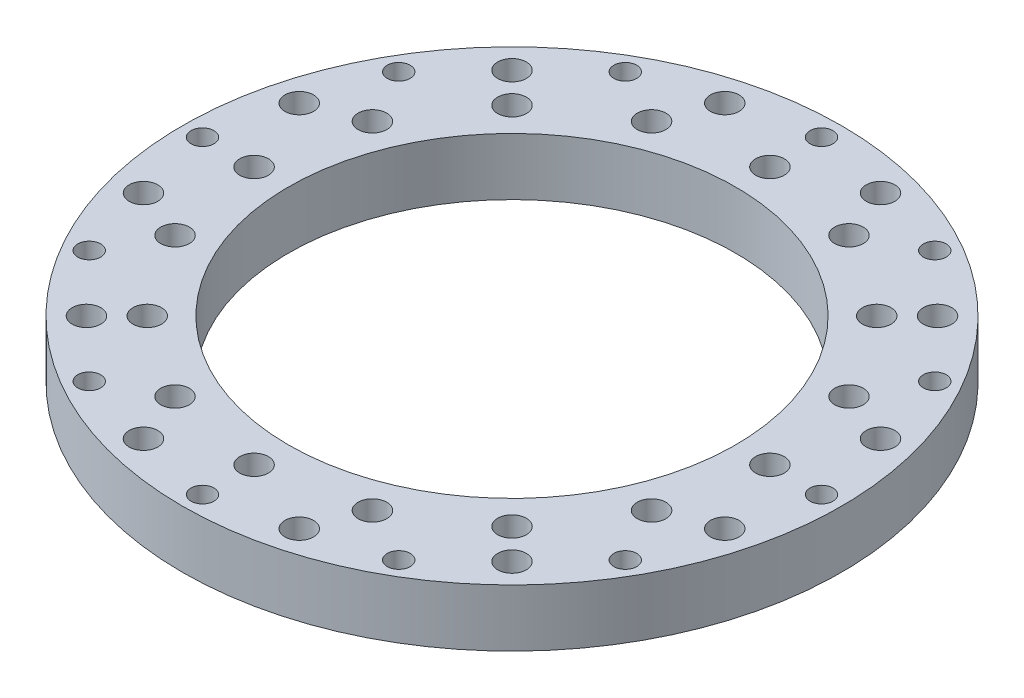
from build123d import *

# Parameters (mm, degrees)
SKETCH1_R           = 57.5
SKETCH1_R_2         = 39
SKETCH1_R_3         = 2
SKETCH1_R_4         = 2.5
BOSS_EXTRUDE1_DEPTH = 10
SKETCH2_R           = 2.5
CUT_EXTRUDE1_DEPTH  = 10
SKETCH4_R           = 5
SKETCH4_R_2         = 2.5
BOSS_EXTRUDE3_DEPTH = 0.4


with BuildPart() as part:
    # Sketch1 → Boss-Extrude1 (new body)
    with BuildSketch(Plane(origin=(0, 0, 0), x_dir=(1, 0, 0), z_dir=(0, 1, 0))):
        with Locations(Location((0, 0, 0), (0, 0, 270))):
            Circle(SKETCH1_R)
        with Locations(Location((0, 0, 0), (0, 0, 270))):
            Circle(SKETCH1_R_2, mode=Mode.SUBTRACT)
        with Locations(Location((0, 54, 0), (0, 0, 270))):
            Circle(SKETCH1_R_3, mode=Mode.SUBTRACT)
        with Locations(Location((27, 46.765371804, 0), (0, 0, 270))):
            Circle(SKETCH1_R_3, mode=Mode.SUBTRACT)
        with Locations(Location((46.765371804, 27, 0), (0, 0, 270))):
            Circle(SKETCH1_R_3, mode=Mode.SUBTRACT)
        with Locations(Location((54, 0, 0), (0, 0, 270))):
            Circle(SKETCH1_R_3, mode=Mode.SUBTRACT)
        with Locations(Location((46.765371804, -27, 0), (0, 0, 270))):
            Circle(SKETCH1_R_3, mode=Mode.SUBTRACT)
        with Locations(Location((27, -46.765371804, 0), (0, 0, 270))):
            Circle(SKETCH1_R_3, mode=Mode.SUBTRACT)
        with Locations(Location((0, -54, 0), (0, 0, 270))):
            Circle(SKETCH1_R_3, mode=Mode.SUBTRACT)
        with Locations(Location((-27, -46.765371804, 0), (0, 0, 270))):
            Circle(SKETCH1_R_3, mode=Mode.SUBTRACT)
        with Locations(Location((-46.765371804, -27, 0), (0, 0, 270))):
            Circle(SKETCH1_R_3, mode=Mode.SUBTRACT)
        with Locations(Location((-54, 0, 0), (0, 0, 270))):
            Circle(SKETCH1_R_3, mode=Mode.SUBTRACT)
        with Locations(Location((-46.765371804, 27, 0), (0, 0, 270))):
            Circle(SKETCH1_R_3, mode=Mode.SUBTRACT)
        with Locations(Location((-27, 46.765371804, 0), (0, 0, 270))):
            Circle(SKETCH1_R_3, mode=Mode.SUBTRACT)
        with Locations(Location((13.587999868, 50.71110588, 0), (0, 0, 270))):
            Circle(SKETCH1_R_4, mode=Mode.SUBTRACT)
        with Locations(Location((37.123106012, 37.123106012, 0), (0, 0, 270))):
            Circle(SKETCH1_R_4, mode=Mode.SUBTRACT)
        with Locations(Location((50.71110588, 13.587999868, 0), (0, 0, 270))):
            Circle(SKETCH1_R_4, mode=Mode.SUBTRACT)
        with Locations(Location((50.71110588, -13.587999868, 0), (0, 0, 270))):
            Circle(SKETCH1_R_4, mode=Mode.SUBTRACT)
        with Locations(Location((37.123106012, -37.123106012, 0), (0, 0, 270))):
            Circle(SKETCH1_R_4, mode=Mode.SUBTRACT)
        with Locations(Location((13.587999868, -50.71110588, 0), (0, 0, 270))):
            Circle(SKETCH1_R_4, mode=Mode.SUBTRACT)
        with Locations(Location((-13.587999868, -50.71110588, 0), (0, 0, 270))):
            Circle(SKETCH1_R_4, mode=Mode.SUBTRACT)
        with Locations(Location((-37.123106012, -37.123106012, 0), (0, 0, 270))):
            Circle(SKETCH1_R_4, mode=Mode.SUBTRACT)
        with Locations(Location((-50.71110588, -13.587999868, 0), (0, 0, 270))):
            Circle(SKETCH1_R_4, mode=Mode.SUBTRACT)
        with Locations(Location((-50.71110588, 13.587999868, 0), (0, 0, 270))):
            Circle(SKETCH1_R_4, mode=Mode.SUBTRACT)
        with Locations(Location((-37.123106012, 37.123106012, 0), (0, 0, 270))):
            Circle(SKETCH1_R_4, mode=Mode.SUBTRACT)
        with Locations(Location((-13.587999868, 50.71110588, 0), (0, 0, 270))):
            Circle(SKETCH1_R_4, mode=Mode.SUBTRACT)
    extrude(amount=BOSS_EXTRUDE1_DEPTH)

    # Sketch2 → Cut-Extrude1 (cut)
    with BuildSketch(Plane(origin=(0, 10, 0), x_dir=(1, 0, 0), z_dir=(0, 1, 0))):
        with Locations(Location((0, 45, 0), (0, 0, 270))):
            Circle(SKETCH2_R)
        with Locations(Location((17.220754456, 41.574578963, 0), (0, 0, 270))):
            Circle(SKETCH2_R)
        with Locations(Location((31.819805153, 31.819805153, 0), (0, 0, 270))):
            Circle(SKETCH2_R)
        with Locations(Location((41.574578963, 17.220754456, 0), (0, 0, 270))):
            Circle(SKETCH2_R)
        with Locations(Location((45, 0, 0), (0, 0, 270))):
            Circle(SKETCH2_R)
        with Locations(Location((41.574578963, -17.220754456, 0), (0, 0, 270))):
            Circle(SKETCH2_R)
        with Locations(Location((31.819805153, -31.819805153, 0), (0, 0, 270))):
            Circle(SKETCH2_R)
        with Locations(Location((17.220754456, -41.574578963, 0), (0, 0, 270))):
            Circle(SKETCH2_R)
        with Locations(Location((0, -45, 0), (0, 0, 270))):
            Circle(SKETCH2_R)
        with Locations(Location((-17.220754456, -41.574578963, 0), (0, 0, 270))):
            Circle(SKETCH2_R)
        with Locations(Location((-31.819805153, -31.819805153, 0), (0, 0, 270))):
            Circle(SKETCH2_R)
        with Locations(Location((-41.574578963, -17.220754456, 0), (0, 0, 270))):
            Circle(SKETCH2_R)
        with Locations(Location((-45, 0, 0), (0, 0, 270))):
            Circle(SKETCH2_R)
        with Locations(Location((-41.574578963, 17.220754456, 0), (0, 0, 270))):
            Circle(SKETCH2_R)
        with Locations(Location((-31.819805153, 31.819805153, 0), (0, 0, 270))):
            Circle(SKETCH2_R)
        with Locations(Location((-17.220754456, 41.574578963, 0), (0, 0, 270))):
            Circle(SKETCH2_R)
    extrude(amount=-CUT_EXTRUDE1_DEPTH, mode=Mode.SUBTRACT)

    # Sketch4 → Boss-Extrude3 (add)
    # profile 1 of 16: a face of its own
    with BuildSketch(Plane(origin=(0, 0, 0), x_dir=(1, 0, 0), z_dir=(0, 1, 0))):
        with Locations(Location((0, 45, 0), (0, 0, 270))):
            Circle(SKETCH4_R)
        with Locations(Location((0, 45, 0), (0, 0, 270))):
            Circle(SKETCH4_R_2, mode=Mode.SUBTRACT)
    # profile 2 of 16: a face of its own
    with BuildSketch(Plane(origin=(0, 0, 0), x_dir=(1, 0, 0), z_dir=(0, 1, 0))):
        with Locations(Location((17.220754456, 41.574578963, 0), (0, 0, 270))):
            Circle(SKETCH4_R)
        with Locations(Location((17.220754456, 41.574578963, 0), (0, 0, 270))):
            Circle(SKETCH4_R_2, mode=Mode.SUBTRACT)
    # profile 3 of 16: a face of its own
    with BuildSketch(Plane(origin=(0, 0, 0), x_dir=(1, 0, 0), z_dir=(0, 1, 0))):
        with Locations(Location((31.819805153, 31.819805153, 0), (0, 0, 270))):
            Circle(SKETCH4_R)
        with Locations(Location((31.819805153, 31.819805153, 0), (0, 0, 270))):
            Circle(SKETCH4_R_2, mode=Mode.SUBTRACT)
    # profile 4 of 16: a face of its own
    with BuildSketch(Plane(origin=(0, 0, 0), x_dir=(1, 0, 0), z_dir=(0, 1, 0))):
        with Locations(Location((41.574578963, 17.220754456, 0), (0, 0, 270))):
            Circle(SKETCH4_R)
        with Locations(Location((41.574578963, 17.220754456, 0), (0, 0, 270))):
            Circle(SKETCH4_R_2, mode=Mode.SUBTRACT)
    # profile 5 of 16: a face of its own
    with BuildSketch(Plane(origin=(0, 0, 0), x_dir=(1, 0, 0), z_dir=(0, 1, 0))):
        with Locations(Location((45, 0, 0), (0, 0, 270))):
            Circle(SKETCH4_R)
        with Locations(Location((45, 0, 0), (0, 0, 270))):
            Circle(SKETCH4_R_2, mode=Mode.SUBTRACT)
    # profile 6 of 16: a face of its own
    with BuildSketch(Plane(origin=(0, 0, 0), x_dir=(1, 0, 0), z_dir=(0, 1, 0))):
        with Locations(Location((41.574578963, -17.220754456, 0), (0, 0, 270))):
            Circle(SKETCH4_R)
        with Locations(Location((41.574578963, -17.220754456, 0), (0, 0, 270))):
            Circle(SKETCH4_R_2, mode=Mode.SUBTRACT)
    # profile 7 of 16: a face of its own
    with BuildSketch(Plane(origin=(0, 0, 0), x_dir=(1, 0, 0), z_dir=(0, 1, 0))):
        with Locations(Location((31.819805153, -31.819805153, 0), (0, 0, 270))):
            Circle(SKETCH4_R)
        with Locations(Location((31.819805153, -31.819805153, 0), (0, 0, 270))):
            Circle(SKETCH4_R_2, mode=Mode.SUBTRACT)
    # profile 8 of 16: a face of its own
    with BuildSketch(Plane(origin=(0, 0, 0), x_dir=(1, 0, 0), z_dir=(0, 1, 0))):
        with Locations(Location((17.220754456, -41.574578963, 0), (0, 0, 270))):
            Circle(SKETCH4_R)
        with Locations(Location((17.220754456, -41.574578963, 0), (0, 0, 270))):
            Circle(SKETCH4_R_2, mode=Mode.SUBTRACT)
    # profile 9 of 16: a face of its own
    with BuildSketch(Plane(origin=(0, 0, 0), x_dir=(1, 0, 0), z_dir=(0, 1, 0))):
        with Locations(Location((0, -45, 0), (0, 0, 270))):
            Circle(SKETCH4_R)
        with Locations(Location((0, -45, 0), (0, 0, 270))):
            Circle(SKETCH4_R_2, mode=Mode.SUBTRACT)
    # profile 10 of 16: a face of its own
    with BuildSketch(Plane(origin=(0, 0, 0), x_dir=(1, 0, 0), z_dir=(0, 1, 0))):
        with Locations(Location((-17.220754456, -41.574578963, 0), (0, 0, 270))):
            Circle(SKETCH4_R)
        with Locations(Location((-17.220754456, -41.574578963, 0), (0, 0, 270))):
            Circle(SKETCH4_R_2, mode=Mode.SUBTRACT)
    # profile 11 of 16: a face of its own
    with BuildSketch(Plane(origin=(0, 0, 0), x_dir=(1, 0, 0), z_dir=(0, 1, 0))):
        with Locations(Location((-31.819805153, -31.819805153, 0), (0, 0, 270))):
            Circle(SKETCH4_R)
        with Locations(Location((-31.819805153, -31.819805153, 0), (0, 0, 270))):
            Circle(SKETCH4_R_2, mode=Mode.SUBTRACT)
    # profile 12 of 16: a face of its own
    with BuildSketch(Plane(origin=(0, 0, 0), x_dir=(1, 0, 0), z_dir=(0, 1, 0))):
        with Locations(Location((-41.574578963, -17.220754456, 0), (0, 0, 270))):
            Circle(SKETCH4_R)
        with Locations(Location((-41.574578963, -17.220754456, 0), (0, 0, 270))):
            Circle(SKETCH4_R_2, mode=Mode.SUBTRACT)
    # profile 13 of 16: a face of its own
    with BuildSketch(Plane(origin=(0, 0, 0), x_dir=(1, 0, 0), z_dir=(0, 1, 0))):
        with Locations(Location((-45, 0, 0), (0, 0, 270))):
            Circle(SKETCH4_R)
        with Locations(Location((-45, 0, 0), (0, 0, 270))):
            Circle(SKETCH4_R_2, mode=Mode.SUBTRACT)
    # profile 14 of 16: a face of its own
    with BuildSketch(Plane(origin=(0, 0, 0), x_dir=(1, 0, 0), z_dir=(0, 1, 0))):
        with Locations(Location((-41.574578963, 17.220754456, 0), (0, 0, 270))):
            Circle(SKETCH4_R)
        with Locations(Location((-41.574578963, 17.220754456, 0), (0, 0, 270))):
            Circle(SKETCH4_R_2, mode=Mode.SUBTRACT)
    # profile 15 of 16: a face of its own
    with BuildSketch(Plane(origin=(0, 0, 0), x_dir=(1, 0, 0), z_dir=(0, 1, 0))):
        with Locations(Location((-31.819805153, 31.819805153, 0), (0, 0, 270))):
            Circle(SKETCH4_R)
        with Locations(Location((-31.819805153, 31.819805153, 0), (0, 0, 270))):
            Circle(SKETCH4_R_2, mode=Mode.SUBTRACT)
    # profile 16 of 16: a face of its own
    with BuildSketch(Plane(origin=(0, 0, 0), x_dir=(1, 0, 0), z_dir=(0, 1, 0))):
        with Locations(Location((-17.220754456, 41.574578963, 0), (0, 0, 270))):
            Circle(SKETCH4_R)
        with Locations(Location((-17.220754456, 41.574578963, 0), (0, 0, 270))):
            Circle(SKETCH4_R_2, mode=Mode.SUBTRACT)
    extrude(amount=-BOSS_EXTRUDE3_DEPTH)


solid = part.part
